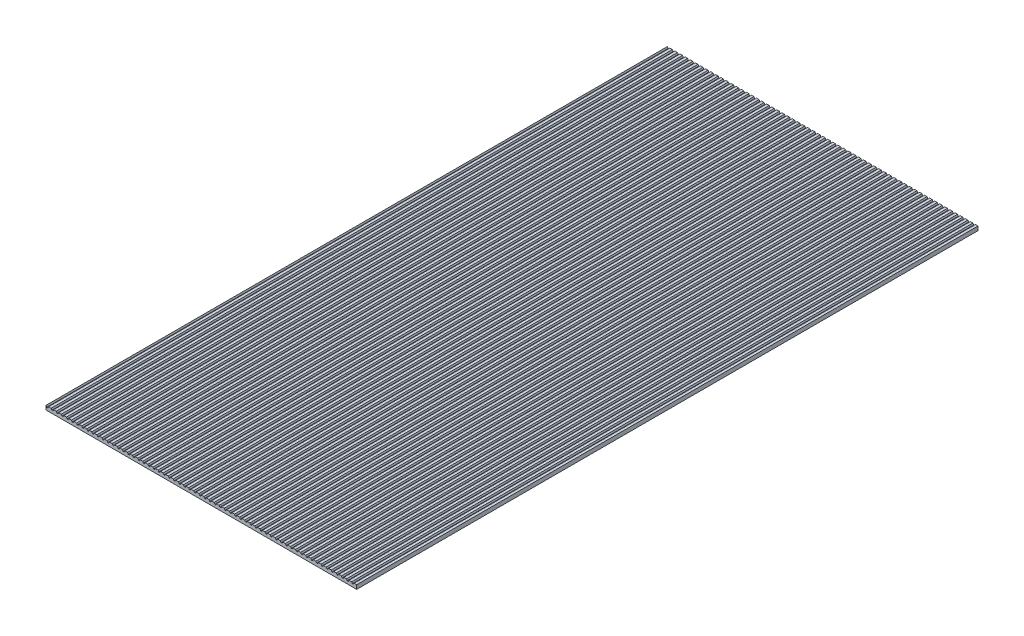
from build123d import *

# Parameters (mm, degrees)
SKETCH1_W           = 1220
SKETCH1_H           = 2440
BOSS_EXTRUDE1_DEPTH = 16
CUT_EXTRUDE1_DEPTH  = 2440


with BuildPart() as part:
    # Sketch1 → Boss-Extrude1 (new body)
    with BuildSketch(Plane(origin=(0, 0, 0), x_dir=(1, 0, 0), z_dir=(0, 1, 0))):
        with Locations((610, 1220)):
            Rectangle(SKETCH1_W, SKETCH1_H)
    extrude(amount=BOSS_EXTRUDE1_DEPTH)

    # Sketch2 → Cut-Extrude1 (cut)
    with BuildSketch(Plane.XY):
        Polygon((0, 16), (3, 10.803847577), (7, 10.803847577), (10, 16), align=None)
        Polygon((30, 16), (20, 16), (23, 10.803847577), (27, 10.803847577), align=None)
        Polygon((50, 16), (40, 16), (43, 10.803847577), (47, 10.803847577), align=None)
        Polygon((70, 16), (60, 16), (63, 10.803847577), (67, 10.803847577), align=None)
        Polygon((90, 16), (80, 16), (83, 10.803847577), (87, 10.803847577), align=None)
        Polygon((110, 16), (100, 16), (103, 10.803847577), (107, 10.803847577), align=None)
        Polygon((130, 16), (120, 16), (123, 10.803847577), (127, 10.803847577), align=None)
        Polygon((150, 16), (140, 16), (143, 10.803847577), (147, 10.803847577), align=None)
        Polygon((170, 16), (160, 16), (163, 10.803847577), (167, 10.803847577), align=None)
        Polygon((190, 16), (180, 16), (183, 10.803847577), (187, 10.803847577), align=None)
        Polygon((210, 16), (200, 16), (203, 10.803847577), (207, 10.803847577), align=None)
        Polygon((230, 16), (220, 16), (223, 10.803847577), (227, 10.803847577), align=None)
        Polygon((250, 16), (240, 16), (243, 10.803847577), (247, 10.803847577), align=None)
        Polygon((270, 16), (260, 16), (263, 10.803847577), (267, 10.803847577), align=None)
        Polygon((290, 16), (280, 16), (283, 10.803847577), (287, 10.803847577), align=None)
        Polygon((310, 16), (300, 16), (303, 10.803847577), (307, 10.803847577), align=None)
        Polygon((330, 16), (320, 16), (323, 10.803847577), (327, 10.803847577), align=None)
        Polygon((350, 16), (340, 16), (343, 10.803847577), (347, 10.803847577), align=None)
        Polygon((370, 16), (360, 16), (363, 10.803847577), (367, 10.803847577), align=None)
        Polygon((390, 16), (380, 16), (383, 10.803847577), (387, 10.803847577), align=None)
        Polygon((410, 16), (400, 16), (403, 10.803847577), (407, 10.803847577), align=None)
        Polygon((430, 16), (420, 16), (423, 10.803847577), (427, 10.803847577), align=None)
        Polygon((450, 16), (440, 16), (443, 10.803847577), (447, 10.803847577), align=None)
        Polygon((470, 16), (460, 16), (463, 10.803847577), (467, 10.803847577), align=None)
        Polygon((490, 16), (480, 16), (483, 10.803847577), (487, 10.803847577), align=None)
        Polygon((510, 16), (500, 16), (503, 10.803847577), (507, 10.803847577), align=None)
        Polygon((530, 16), (520, 16), (523, 10.803847577), (527, 10.803847577), align=None)
        Polygon((550, 16), (540, 16), (543, 10.803847577), (547, 10.803847577), align=None)
        Polygon((570, 16), (560, 16), (563, 10.803847577), (567, 10.803847577), align=None)
        Polygon((590, 16), (580, 16), (583, 10.803847577), (587, 10.803847577), align=None)
        Polygon((610, 16), (600, 16), (603, 10.803847577), (607, 10.803847577), align=None)
        Polygon((630, 16), (620, 16), (623, 10.803847577), (627, 10.803847577), align=None)
        Polygon((650, 16), (640, 16), (643, 10.803847577), (647, 10.803847577), align=None)
        Polygon((670, 16), (660, 16), (663, 10.803847577), (667, 10.803847577), align=None)
        Polygon((690, 16), (680, 16), (683, 10.803847577), (687, 10.803847577), align=None)
        Polygon((710, 16), (700, 16), (703, 10.803847577), (707, 10.803847577), align=None)
        Polygon((730, 16), (720, 16), (723, 10.803847577), (727, 10.803847577), align=None)
        Polygon((750, 16), (740, 16), (743, 10.803847577), (747, 10.803847577), align=None)
        Polygon((770, 16), (760, 16), (763, 10.803847577), (767, 10.803847577), align=None)
        Polygon((790, 16), (780, 16), (783, 10.803847577), (787, 10.803847577), align=None)
        Polygon((810, 16), (800, 16), (803, 10.803847577), (807, 10.803847577), align=None)
        Polygon((830, 16), (820, 16), (823, 10.803847577), (827, 10.803847577), align=None)
        Polygon((850, 16), (840, 16), (843, 10.803847577), (847, 10.803847577), align=None)
        Polygon((870, 16), (860, 16), (863, 10.803847577), (867, 10.803847577), align=None)
        Polygon((890, 16), (880, 16), (883, 10.803847577), (887, 10.803847577), align=None)
        Polygon((910, 16), (900, 16), (903, 10.803847577), (907, 10.803847577), align=None)
        Polygon((930, 16), (920, 16), (923, 10.803847577), (927, 10.803847577), align=None)
        Polygon((950, 16), (940, 16), (943, 10.803847577), (947, 10.803847577), align=None)
        Polygon((970, 16), (960, 16), (963, 10.803847577), (967, 10.803847577), align=None)
        Polygon((990, 16), (980, 16), (983, 10.803847577), (987, 10.803847577), align=None)
        Polygon((1010, 16), (1000, 16), (1003, 10.803847577), (1007, 10.803847577), align=None)
        Polygon((1030, 16), (1020, 16), (1023, 10.803847577), (1027, 10.803847577), align=None)
        Polygon((1050, 16), (1040, 16), (1043, 10.803847577), (1047, 10.803847577), align=None)
        Polygon((1070, 16), (1060, 16), (1063, 10.803847577), (1067, 10.803847577), align=None)
        Polygon((1090, 16), (1080, 16), (1083, 10.803847577), (1087, 10.803847577), align=None)
        Polygon((1110, 16), (1100, 16), (1103, 10.803847577), (1107, 10.803847577), align=None)
        Polygon((1130, 16), (1120, 16), (1123, 10.803847577), (1127, 10.803847577), align=None)
        Polygon((1150, 16), (1140, 16), (1143, 10.803847577), (1147, 10.803847577), align=None)
        Polygon((1170, 16), (1160, 16), (1163, 10.803847577), (1167, 10.803847577), align=None)
        Polygon((1190, 16), (1180, 16), (1183, 10.803847577), (1187, 10.803847577), align=None)
        Polygon((1210, 16), (1200, 16), (1203, 10.803847577), (1207, 10.803847577), align=None)
    extrude(amount=-CUT_EXTRUDE1_DEPTH, mode=Mode.SUBTRACT)


solid = part.part
